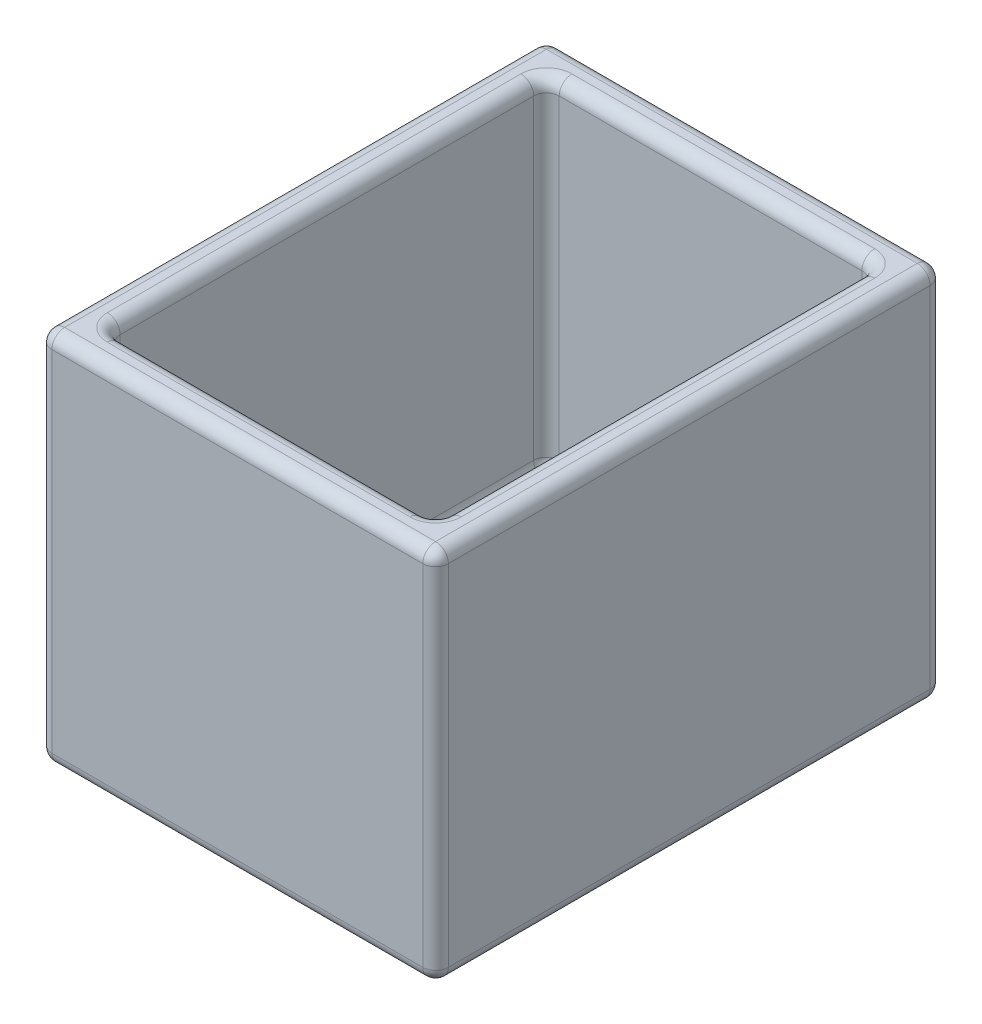
from build123d import *

# Parameters (mm, degrees)
SKETCH1_W           = 38.5
SKETCH1_H           = 51.5
BOSS_EXTRUDE1_DEPTH = 40
SHELL1_T            = 4
SKETCH2_R           = 2.5
CUT_EXTRUDE3_DEPTH  = 4
FILLET2_R           = 1.5
SKETCH5_R           = 2
CUT_EXTRUDE4_DEPTH  = 56.005681525


with BuildPart() as part:
    # Sketch1 → Boss-Extrude1 (new body)
    with BuildSketch(Plane(origin=(0, 0, 0), x_dir=(1, 0, 0), z_dir=(0, 1, 0))):
        Rectangle(SKETCH1_W, SKETCH1_H)
    extrude(amount=BOSS_EXTRUDE1_DEPTH)

    # Shell1
    shell1_openings = [part.faces().sort_by_distance(p)[0] for p in [
        (0, 40, 0),
    ]]
    offset(amount=SHELL1_T, openings=shell1_openings, kind=Kind.INTERSECTION)

    # Sketch2 → Cut-Extrude3 (cut)
    with BuildSketch(Plane(origin=(0, 0, -29.75), x_dir=(-1, 0, 0), z_dir=(0, 0, -1))):
        with Locations(Location((0, 6, 0), (0, 0, 180))):
            Circle(SKETCH2_R)
    extrude(amount=-CUT_EXTRUDE3_DEPTH, mode=Mode.SUBTRACT)

    # Fillet2
    fillet2_edges = [part.edges().sort_by_distance(p)[0] for p in [
        (23.25, 40, 0),
        (0, 40, -29.75),
        (-19.25, 0, 0),
        (-19.25, 20, -25.75),
        (0, 0, 25.75),
        (-19.25, 20, 25.75),
        (19.25, 0, 0),
        (19.25, 20, 25.75),
        (0, 0, -25.75),
        (19.25, 20, -25.75),
        (-19.25, 40, 0),
        (0, 40, 25.75),
        (19.25, 40, 0),
        (0, 40, -25.75),
        (-23.25, 40, 0),
        (0, -4, -29.75),
        (23.25, -4, 0),
        (0, -4, 29.75),
        (-23.25, -4, 0),
        (-23.25, 18, -29.75),
        (23.25, 18, -29.75),
        (23.25, 18, 29.75),
        (-23.25, 18, 29.75),
        (0, 40, 29.75),
    ]]
    fillet(fillet2_edges, radius=FILLET2_R)

    # Sketch5 → Cut-Extrude4 (cut, through all)
    with BuildSketch(Plane(origin=(0, 0, 0), x_dir=(1, 0, 0), z_dir=(0, 1, 0))):
        with Locations(Location((-4.25, -16.25, 0), (0, 0, 270))):
            Circle(SKETCH5_R)
    extrude(amount=-CUT_EXTRUDE4_DEPTH, mode=Mode.SUBTRACT)


solid = part.part
